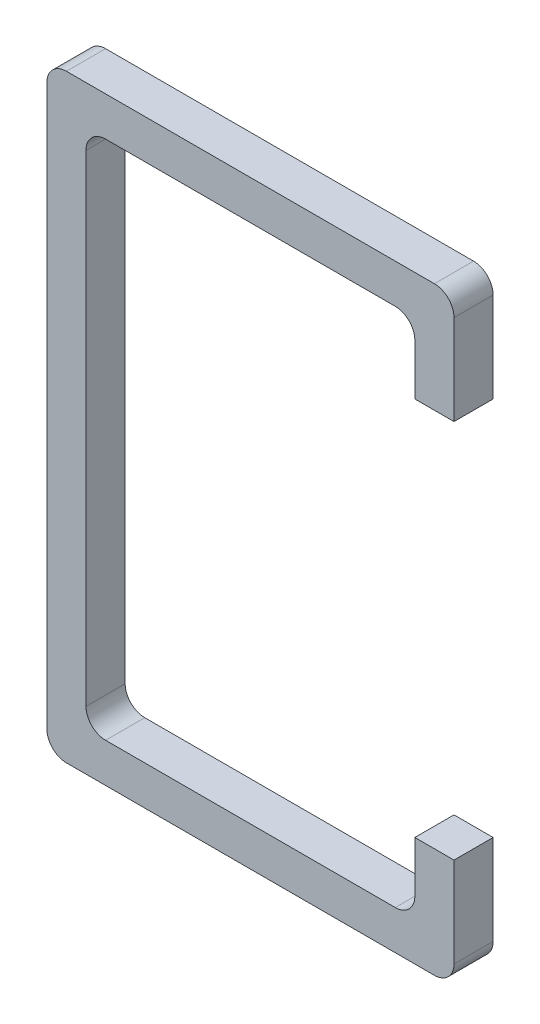
from build123d import *

# Parameters (mm, degrees)
SKETCH1_W               = 104
SKETCH1_H               = 153
BOSS_EXTRUDE1_DEPTH     = 10
CUT_EXTRUDE1_DEPTH      = 156.226704492
CUT_EXTRUDE1_DEPTH_BACK = 156.226704492
SKETCH2_W               = 84
SKETCH2_H               = 133
CUT_EXTRUDE3_DEPTH      = 156.226704492
CUT_EXTRUDE3_DEPTH_BACK = 156.226704492
SKETCH3_W               = 10
SKETCH3_H               = 97
FILLET9_R               = 5
FILLET10_R              = 5
FILLET11_R              = 5
FILLET12_R              = 5


with BuildPart() as part:
    # Sketch1 → Boss-Extrude1 (new body)
    with BuildSketch(Plane.XY):
        with Locations((25.638107417, -57.543478261)):
            Rectangle(SKETCH1_W, SKETCH1_H)
    extrude(amount=BOSS_EXTRUDE1_DEPTH)

    # Sketch2 → Cut-Extrude1 (cut, two sides: drawn at the far end of the back side and taken through both)
    with BuildSketch(Plane.XY.offset(10).offset(-CUT_EXTRUDE1_DEPTH_BACK)):
        with Locations((25.638107417, -57.543478261)):
            Rectangle(SKETCH2_W, SKETCH2_H)
    extrude(amount=CUT_EXTRUDE1_DEPTH + CUT_EXTRUDE1_DEPTH_BACK, mode=Mode.SUBTRACT)

    # Sketch3 → Cut-Extrude3 (cut, two sides: drawn at the far end of the back side and taken through both)
    with BuildSketch(Plane.XY.offset(10).offset(-CUT_EXTRUDE3_DEPTH_BACK)):
        with Locations((72.638107417, -57.543478261)):
            Rectangle(SKETCH3_W, SKETCH3_H)
    extrude(amount=CUT_EXTRUDE3_DEPTH + CUT_EXTRUDE3_DEPTH_BACK, mode=Mode.SUBTRACT)

    # Fillet9
    fillet9_edges = [part.edges().sort_by_distance(p)[0] for p in [
        (-16.361892583, 8.956521739, 5),
    ]]
    fillet(fillet9_edges, radius=FILLET9_R)

    # Fillet10
    fillet10_edges = [part.edges().sort_by_distance(p)[0] for p in [
        (67.638107417, 8.956521739, 5),
        (-26.361892583, 18.956521739, 5),
    ]]
    fillet(fillet10_edges, radius=FILLET10_R)

    # Fillet11
    fillet11_edges = [part.edges().sort_by_distance(p)[0] for p in [
        (67.638107417, -124.043478261, 5),
        (77.638107417, 18.956521739, 5),
        (-26.361892583, -134.043478261, 5),
    ]]
    fillet(fillet11_edges, radius=FILLET11_R)

    # Fillet12
    fillet12_edges = [part.edges().sort_by_distance(p)[0] for p in [
        (-16.361892583, -124.043478261, 5),
        (77.638107417, -134.043478261, 5),
    ]]
    fillet(fillet12_edges, radius=FILLET12_R)


solid = part.part
